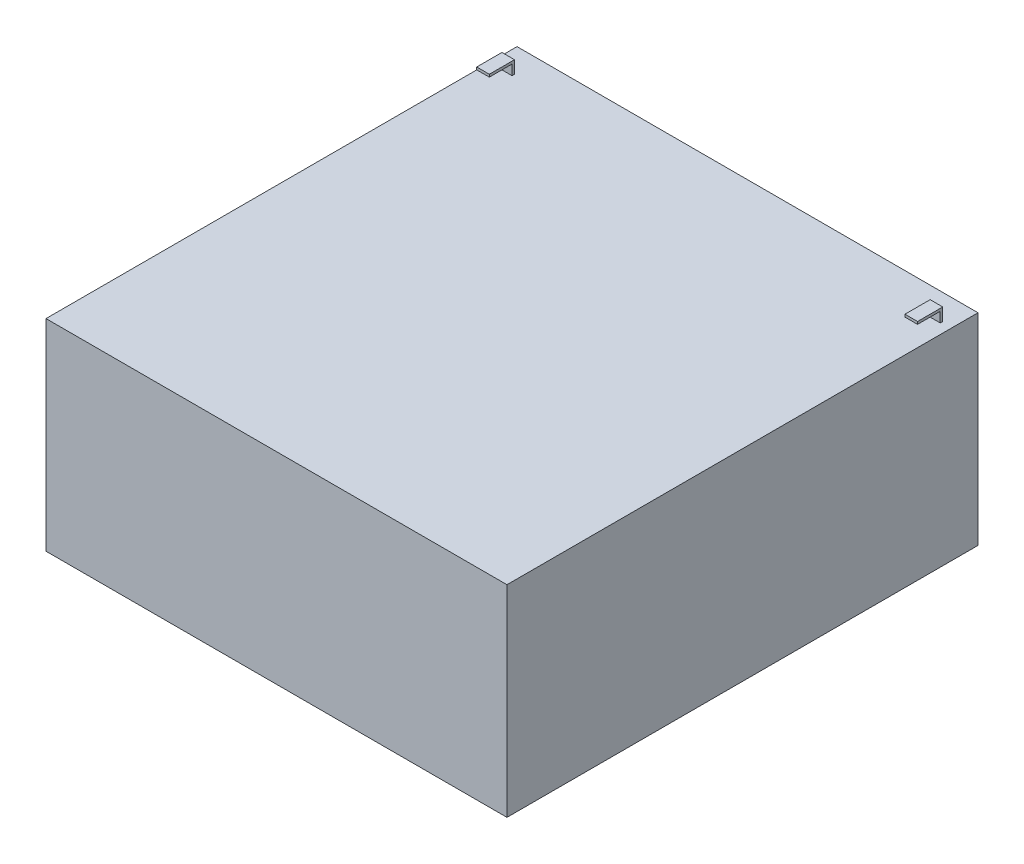
from build123d import *

# Parameters (mm, degrees)
SKETCH_1_W      = 183
SKETCH_1_H      = 187
EXTRUDE_1_DEPTH = 80
SKETCH_3_W      = 5
SKETCH_3_H      = 1


with BuildPart() as part:
    # 草图1 → 拉伸1 (new body)
    with BuildSketch(Plane(origin=(0, 0, 0), x_dir=(1, 0, 0), z_dir=(0, 1, 0))):
        with Locations((91.5, 93.5)):
            Rectangle(SKETCH_1_W, SKETCH_1_H)
    extrude(amount=EXTRUDE_1_DEPTH)

    # 扫描1: sweep along a path in 草图4
    with BuildLine(Plane.ZY.offset(-4)) as sweep_1_path:
        Line((-177, 80), (-177, 85))
        Line((-177, 85), (-167, 85))
    # 草图3 → 扫描1 (sweep)
    with BuildSketch(Plane(origin=(0, 80, 0), x_dir=(-1, 0, 0), z_dir=(0, 1, 0))):
        with Locations((-6.5, -176.5)):
            Rectangle(SKETCH_3_W, SKETCH_3_H)
    sweep_1 = sweep(path=sweep_1_path.line, transition=Transition.RIGHT)

    # 镜向2: 扫描1 across plane
    add(sweep_1.mirror(Plane.ZY.offset(-91.5)))


solid = part.part
